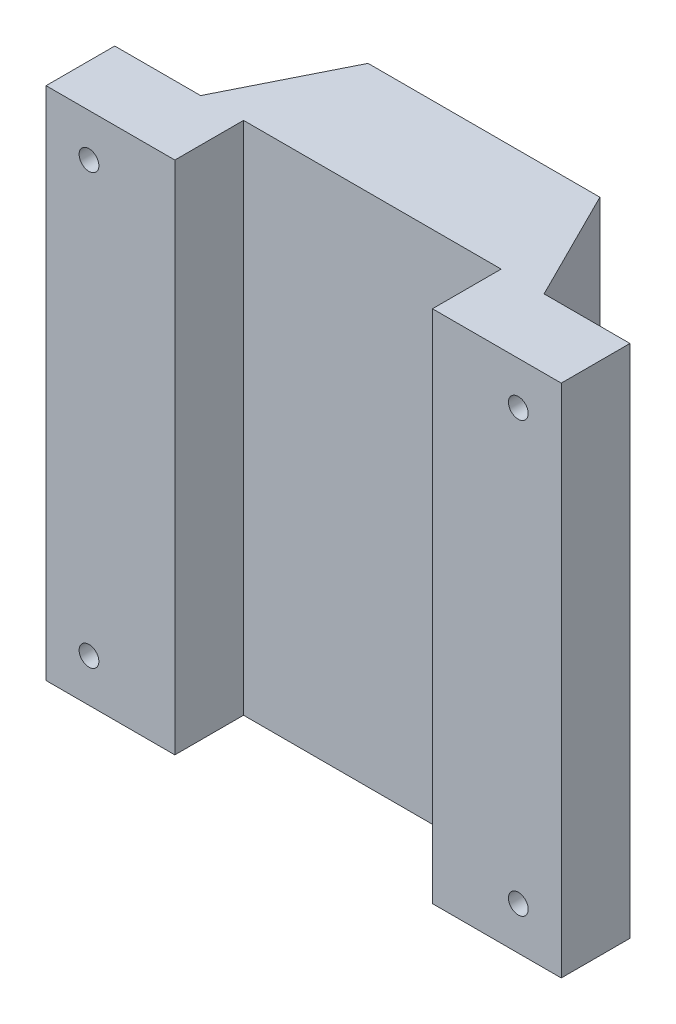
from build123d import *

# Parameters (mm, degrees)
SKETCH1_W           = 60
SKETCH1_H           = 60
BOSS_EXTRUDE1_DEPTH = 13
SKETCH2_W           = 15
SKETCH2_H           = 60
BOSS_EXTRUDE2_DEPTH = 8
SKETCH3_R           = 1.15
CUT_EXTRUDE1_DEPTH  = 48.339201514
SKETCH4_R           = 2.2
CUT_EXTRUDE2_DEPTH  = 18
CUT_EXTRUDE4_DEPTH  = 71.292247083


with BuildPart() as part:
    # Sketch1 → Boss-Extrude1 (new body)
    with BuildSketch(Plane.XY):
        Rectangle(SKETCH1_W, SKETCH1_H)
    extrude(amount=BOSS_EXTRUDE1_DEPTH)

    # Sketch2 → Boss-Extrude2 (add)
    with BuildSketch(Plane.XY.offset(13)):
        with Locations((-22.5, 0)):
            Rectangle(SKETCH2_W, SKETCH2_H)
        with Locations((22.5, 0)):
            Rectangle(SKETCH2_W, SKETCH2_H)
    extrude(amount=BOSS_EXTRUDE2_DEPTH)

    # Sketch3 → Cut-Extrude1 (cut, through all)
    with BuildSketch(Plane(origin=(0, 0, 0), x_dir=(-1, 0, 0), z_dir=(0, 0, -1))):
        with Locations((25, 25)):
            Circle(SKETCH3_R)
        with Locations((25, -25)):
            Circle(SKETCH3_R)
        with Locations((-25, -25)):
            Circle(SKETCH3_R)
        with BuildLine():
            ThreePointArc((-25.813172798, 25.813172798), (-25.813172798, 24.186827202), (-24.186827202, 24.186827202))
            Line((-24.186827202, 24.186827202), (-25.813172798, 25.813172798))
        make_face()
        with BuildLine():
            Line((-25.813172798, 25.813172798), (-24.186827202, 24.186827202))
            ThreePointArc((-24.186827202, 24.186827202), (-23.937538538, 24.559914053), (-23.85, 25))
            ThreePointArc((-23.85, 25), (-24.559914053, 26.062461462), (-25.813172798, 25.813172798))
        make_face()
    extrude(amount=-CUT_EXTRUDE1_DEPTH, mode=Mode.SUBTRACT)

    # Sketch4 → Cut-Extrude2 (cut)
    with BuildSketch(Plane(origin=(0, 0, 0), x_dir=(-1, 0, 0), z_dir=(0, 0, -1))):
        with Locations((-25, 25)):
            Circle(SKETCH4_R)
        with Locations((25, 25)):
            Circle(SKETCH4_R)
        with Locations((25, -25)):
            Circle(SKETCH4_R)
        with Locations((-25, -25)):
            Circle(SKETCH4_R)
    extrude(amount=-CUT_EXTRUDE2_DEPTH, mode=Mode.SUBTRACT)

    # Sketch6 → Cut-Extrude4 (cut, through all)
    with BuildSketch(Plane(origin=(0, 30, 0), x_dir=(1, 0, 0), z_dir=(0, 1, 0))):
        Polygon((-30, 0), (-30, -13), (-20, -13), (-13.5, 0), align=None)
        Polygon((30, 0), (13.5, 0), (20, -13), (30, -13), align=None)
    extrude(amount=-CUT_EXTRUDE4_DEPTH, mode=Mode.SUBTRACT)


solid = part.part
